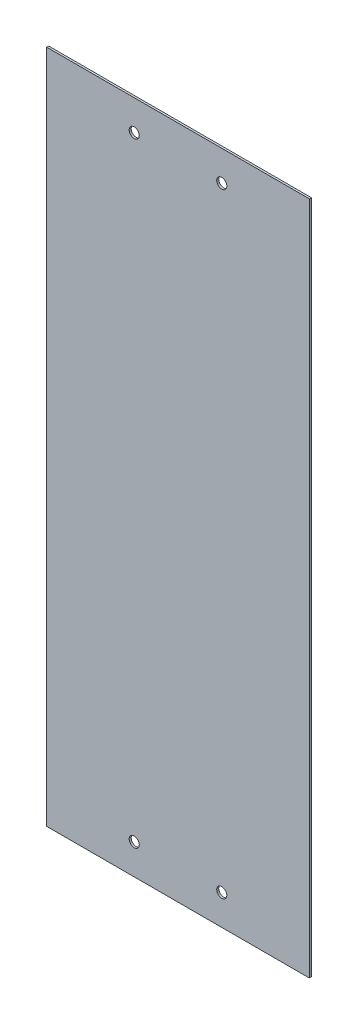
from build123d import *

# Parameters (mm, degrees)
CROQUIS1_R              = 2.5
SALIENTE_EXTRUIR1_DEPTH = 1


with BuildPart() as part:
    # Croquis1 → Saliente-Extruir1 (new body)
    with BuildSketch(Plane.XY):
        Polygon((65, 167), (-65, 167), (-65, 152), (-65, -167), (65, -167), align=None)
        with Locations((-21.666666667, -152)):
            Circle(CROQUIS1_R, mode=Mode.SUBTRACT)
        with Locations((21.666666667, -152)):
            Circle(CROQUIS1_R, mode=Mode.SUBTRACT)
        with Locations((-21.666666667, 152)):
            Circle(CROQUIS1_R, mode=Mode.SUBTRACT)
        with Locations((21.666666667, 152)):
            Circle(CROQUIS1_R, mode=Mode.SUBTRACT)
    extrude(amount=SALIENTE_EXTRUIR1_DEPTH)


solid = part.part
